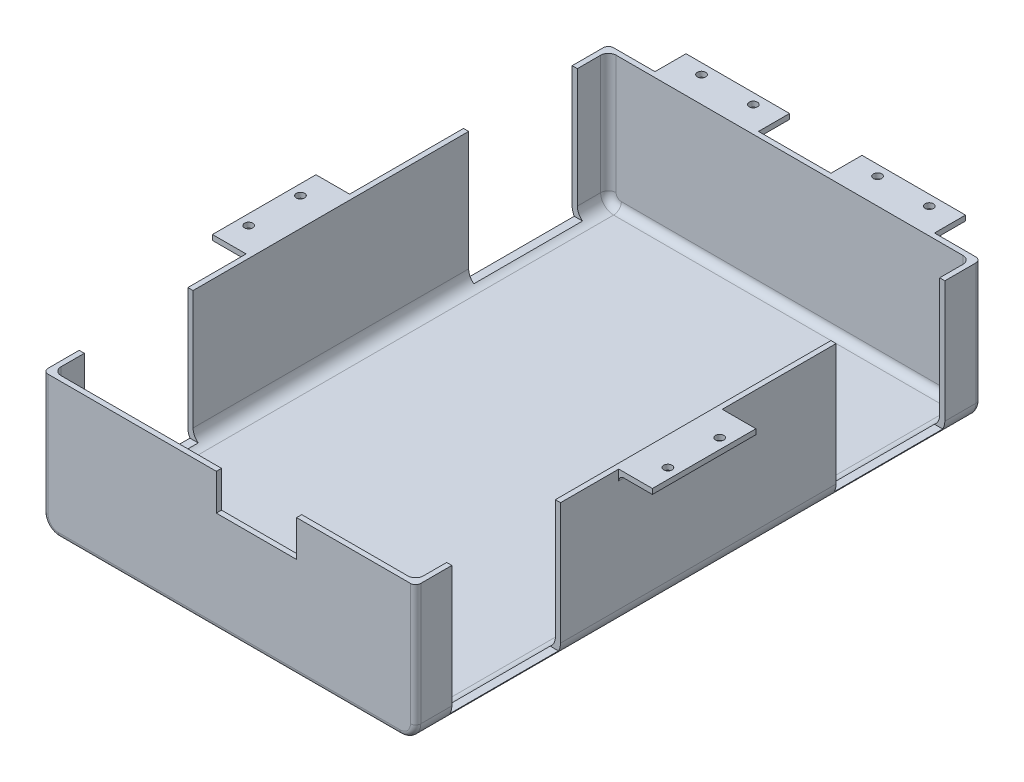
from build123d import *

# Parameters (mm, degrees)
EXTRUDE_1_DEPTH     = 214.5
EXTRUDE_2_DEPTH     = 2
EXTRUDE_START       = 2
EXTRUDE_3_DEPTH     = 2
FILLET_2_R          = 3
FILLET_3_R          = 3
SKETCH_6_W          = 40
SKETCH_6_H          = 12
SKETCH_6_R          = 1.6
SKETCH_6_W_2        = 13
SKETCH_6_H_2        = 40
EXTRUDE_4_DEPTH     = 2
SKETCH_8_W          = 31
SKETCH_8_H          = 14
CUT_EXTRUDE_2_DEPTH = 10
FILLET_4_R          = 2
FILLET_5_R          = 2
SKETCH_9_W          = 42
SKETCH_9_H          = 50
CUT_EXTRUDE_3_DEPTH = 273.635746006
SKETCH_10_W         = 42
SKETCH_10_H         = 50
CUT_EXTRUDE_4_DEPTH = 273.635746006


with BuildPart() as part:
    # 草图1 → 凸台-拉伸1 (new body)
    with BuildSketch(Plane.XY):
        with BuildLine():
            Line((-68, 0), (64, 0))
            ThreePointArc((64, 0), (68.242640687, 1.757359313), (70, 6))
            Line((70, 6), (70, 53))
            Line((70, 53), (68, 53))
            Line((68, 53), (68, 7))
            ThreePointArc((68, 7), (66.535533906, 3.464466094), (63, 2))
            Line((63, 2), (-67, 2))
            ThreePointArc((-67, 2), (-70.535533906, 3.464466094), (-72, 7))
            Line((-72, 7), (-72, 53))
            Line((-72, 53), (-74, 53))
            Line((-74, 53), (-74, 6))
            ThreePointArc((-74, 6), (-72.242640687, 1.757359313), (-68, 0))
        make_face()
    extrude(amount=EXTRUDE_1_DEPTH)

    # 草图2 → 凸台-拉伸2 (add)
    with BuildSketch(Plane.XY.offset(214.5)):
        with BuildLine():
            Line((-68, 0), (64, 0))
            ThreePointArc((64, 0), (68.242640687, 1.757359313), (70, 6))
            Line((70, 6), (70, 53))
            Line((70, 53), (-74, 53))
            Line((-74, 53), (-74, 6))
            ThreePointArc((-74, 6), (-72.242640687, 1.757359313), (-68, 0))
        make_face()
    extrude(amount=EXTRUDE_2_DEPTH)

    # 草图3 → 凸台-拉伸3 (add)
    with BuildSketch(Plane(origin=(0, 0, 0), x_dir=(-1, 0, 0), z_dir=(0, 0, -1)).offset(EXTRUDE_START)):
        with BuildLine():
            Line((-64, 0), (68, 0))
            ThreePointArc((68, 0), (72.242640687, 1.757359313), (74, 6))
            Line((74, 6), (74, 53))
            Line((74, 53), (-70, 53))
            Line((-70, 53), (-70, 6))
            ThreePointArc((-70, 6), (-68.242640687, 1.757359313), (-64, 0))
        make_face()
    extrude(amount=-EXTRUDE_3_DEPTH)

    # 圆角2
    fillet_2_edges = [part.edges().sort_by_distance(p)[0] for p in [
        (68, 30, 214.5),
        (66.535533906, 3.464466094, 214.5),
        (-2, 2, 214.5),
        (-70.535533906, 3.464466094, 214.5),
        (-72, 30, 214.5),
    ]]
    fillet(fillet_2_edges, radius=FILLET_2_R)

    # 圆角3
    fillet_3_edges = [part.edges().sort_by_distance(p)[0] for p in [
        (-72, 30, 0),
        (-70.535533906, 3.464466094, 0),
        (-2, 2, 0),
        (66.535533906, 3.464466094, 0),
        (68, 30, 0),
    ]]
    fillet(fillet_3_edges, radius=FILLET_3_R)

    # 草图6 → 凸台-拉伸4 (add)
    # profile 1 of 4: a face of its own
    with BuildSketch(Plane(origin=(0, 53, 0), x_dir=(1, 0, 0), z_dir=(0, 1, 0))):
        with Locations((-36, 8)):
            Rectangle(SKETCH_6_W, SKETCH_6_H)
        with Locations(Location((-46, 10, 0), (0, 0, 270))):
            Circle(SKETCH_6_R, mode=Mode.SUBTRACT)
        with Locations(Location((-26, 10, 0), (0, 0, 270))):
            Circle(SKETCH_6_R, mode=Mode.SUBTRACT)
    # profile 2 of 4: a face of its own
    with BuildSketch(Plane(origin=(0, 53, 0), x_dir=(1, 0, 0), z_dir=(0, 1, 0))):
        with Locations((-80.5, -118)):
            Rectangle(SKETCH_6_W_2, SKETCH_6_H_2)
        with Locations(Location((-83, -108, 0), (0, 0, 270))):
            Circle(SKETCH_6_R, mode=Mode.SUBTRACT)
        with Locations(Location((-83, -128, 0), (0, 0, 270))):
            Circle(SKETCH_6_R, mode=Mode.SUBTRACT)
    # profile 3 of 4: a face of its own
    with BuildSketch(Plane(origin=(0, 53, 0), x_dir=(1, 0, 0), z_dir=(0, 1, 0))):
        with Locations((76.5, -118)):
            Rectangle(SKETCH_6_W_2, SKETCH_6_H_2)
        with Locations(Location((79, -128, 0), (0, 0, 90))):
            Circle(SKETCH_6_R, mode=Mode.SUBTRACT)
        with Locations(Location((79, -108, 0), (0, 0, 90))):
            Circle(SKETCH_6_R, mode=Mode.SUBTRACT)
    # profile 4 of 4: a face of its own
    with BuildSketch(Plane(origin=(0, 53, 0), x_dir=(1, 0, 0), z_dir=(0, 1, 0))):
        with Locations((32, 8)):
            Rectangle(SKETCH_6_W, SKETCH_6_H)
        with Locations(Location((42, 10, 0), (0, 0, 90))):
            Circle(SKETCH_6_R, mode=Mode.SUBTRACT)
        with Locations(Location((22, 10, 0), (0, 0, 90))):
            Circle(SKETCH_6_R, mode=Mode.SUBTRACT)
    extrude(amount=-EXTRUDE_4_DEPTH)

    # 草图8 → 切除-拉伸2 (cut)
    with BuildSketch(Plane.XY.offset(216.5)):
        with Locations((8.5, 46)):
            Rectangle(SKETCH_8_W, SKETCH_8_H)
    extrude(amount=-CUT_EXTRUDE_2_DEPTH, mode=Mode.SUBTRACT)

    # 圆角4
    fillet_4_edges = [part.edges().sort_by_distance(p)[0] for p in [
        (-36, 51, -2),
        (32, 51, -2),
        (-74, 51, 118),
        (70, 51, 118),
    ]]
    fillet(fillet_4_edges, radius=FILLET_4_R)

    # 圆角5
    fillet_5_edges = [part.edges().sort_by_distance(p)[0] for p in [
        (70, 29.5, 216.5),
        (-74, 29.5, 216.5),
        (-72.242640687, 1.757359313, 216.5),
        (-2, 0, 216.5),
        (68.242640687, 1.757359313, 216.5),
        (-74, 29.5, -2),
        (70, 29.5, -2),
        (68.242640687, 1.757359313, -2),
        (-2, 0, -2),
        (-72.242640687, 1.757359313, -2),
    ]]
    fillet(fillet_5_edges, radius=FILLET_5_R)

    # 草图9 → 切除-拉伸3 (cut, through all)
    with BuildSketch(Plane(origin=(70, 0, 0), x_dir=(0, 0, -1), z_dir=(1, 0, 0))):
        with Locations((-181.5, 28)):
            Rectangle(SKETCH_9_W, SKETCH_9_H)
    extrude(amount=-CUT_EXTRUDE_3_DEPTH, mode=Mode.SUBTRACT)

    # 草图10 → 切除-拉伸4 (cut, through all)
    with BuildSketch(Plane(origin=(70, 0, 0), x_dir=(0, 0, -1), z_dir=(1, 0, 0))):
        with Locations((-33, 28)):
            Rectangle(SKETCH_10_W, SKETCH_10_H)
    extrude(amount=-CUT_EXTRUDE_4_DEPTH, mode=Mode.SUBTRACT)


solid = part.part
